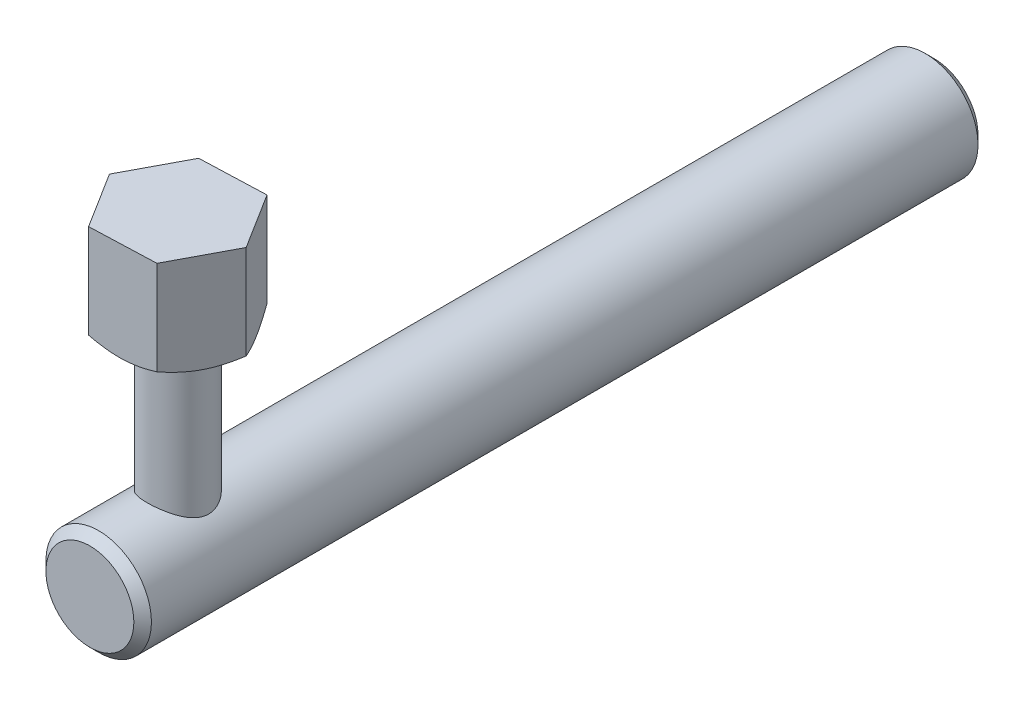
from build123d import *

# Parameters (mm, degrees)
SKETCH_1_R      = 3
EXTRUDE_1_DEPTH = 48
SKETCH_2_R      = 1.75
EXTRUDE_2_DEPTH = 10
EXTRUDE_3_DEPTH = 6.5
CHAMFER_1_SIZE  = 0.5


with BuildPart() as part:
    # 草图1 → 凸台-拉伸1 (new body)
    with BuildSketch(Plane.XY):
        Circle(SKETCH_1_R)
    extrude(amount=EXTRUDE_1_DEPTH)

    # 草图2 → 凸台-拉伸2 (add)
    with BuildSketch(Plane(origin=(0, 0, 0), x_dir=(1, 0, 0), z_dir=(0, 1, 0))):
        with Locations(Location((0, -43, 0), (0, 0, 90))):
            Circle(SKETCH_2_R)
    extrude(amount=EXTRUDE_2_DEPTH)

    # 草图3 → 凸台-拉伸3 (add)
    with BuildSketch(Plane(origin=(0, 10, 0), x_dir=(1, 0, 0), z_dir=(0, 1, 0))):
        Polygon((-1.993644271, -39.820579321), (-3.750281213, -43.136836245), (-1.756636942, -46.316256924), (1.993644271, -46.179420679), (3.750281213, -42.863163755), (1.756636942, -39.683743076), align=None)
    extrude(amount=EXTRUDE_3_DEPTH)

    # 草图4 → 切除-旋转1 (revolve, cut)
    with BuildSketch(Plane(origin=(0, 0, 0), x_dir=(0, 0, -1), z_dir=(1, 0, 0))):
        Polygon((-44.75, 10), (-47.118639965, 11.367534921), (-47.118639965, 10), align=None)
    revolve(axis=Axis((0, 10, 43), (0, -1, 0)), mode=Mode.SUBTRACT)

    # 倒角1
    chamfer_1_edges = [part.edges().sort_by_distance(p)[0] for p in [
        (-3, 0, 0),
        (-3, 0, 48),
    ]]
    chamfer(chamfer_1_edges, length=CHAMFER_1_SIZE)


solid = part.part
